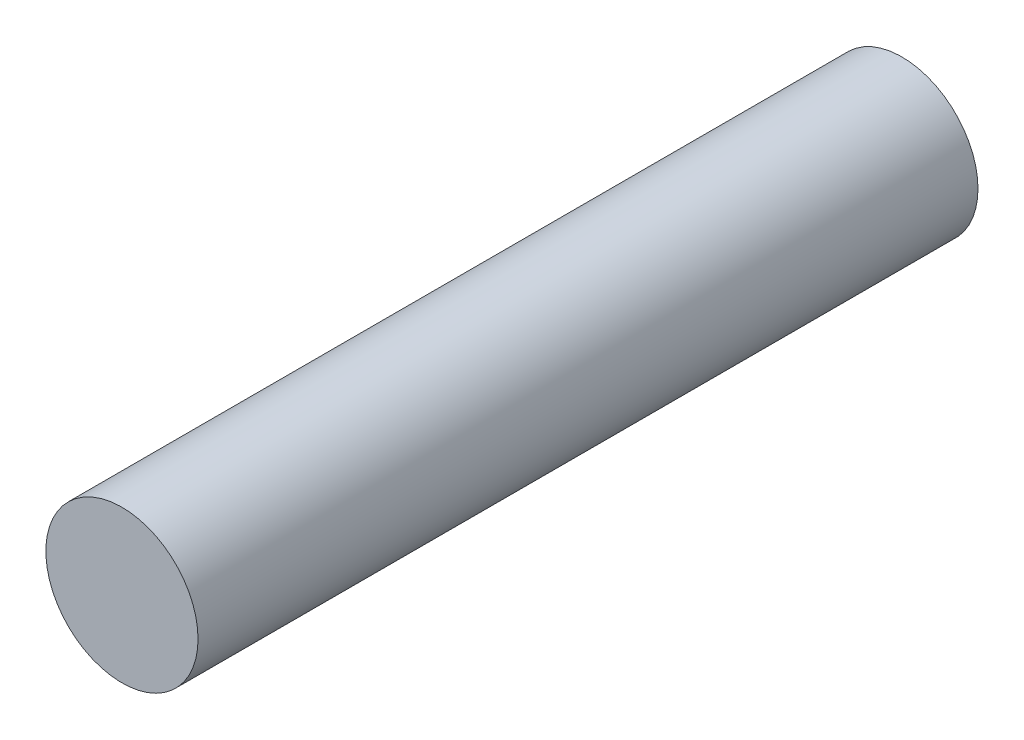
from build123d import *

# Parameters (mm, degrees)
SKETCH1_R           = 4
BOSS_EXTRUDE1_DEPTH = 41


with BuildPart() as part:
    # Sketch1 → Boss-Extrude1 (new body)
    with BuildSketch(Plane.XY):
        Circle(SKETCH1_R)
    extrude(amount=BOSS_EXTRUDE1_DEPTH)


solid = part.part
